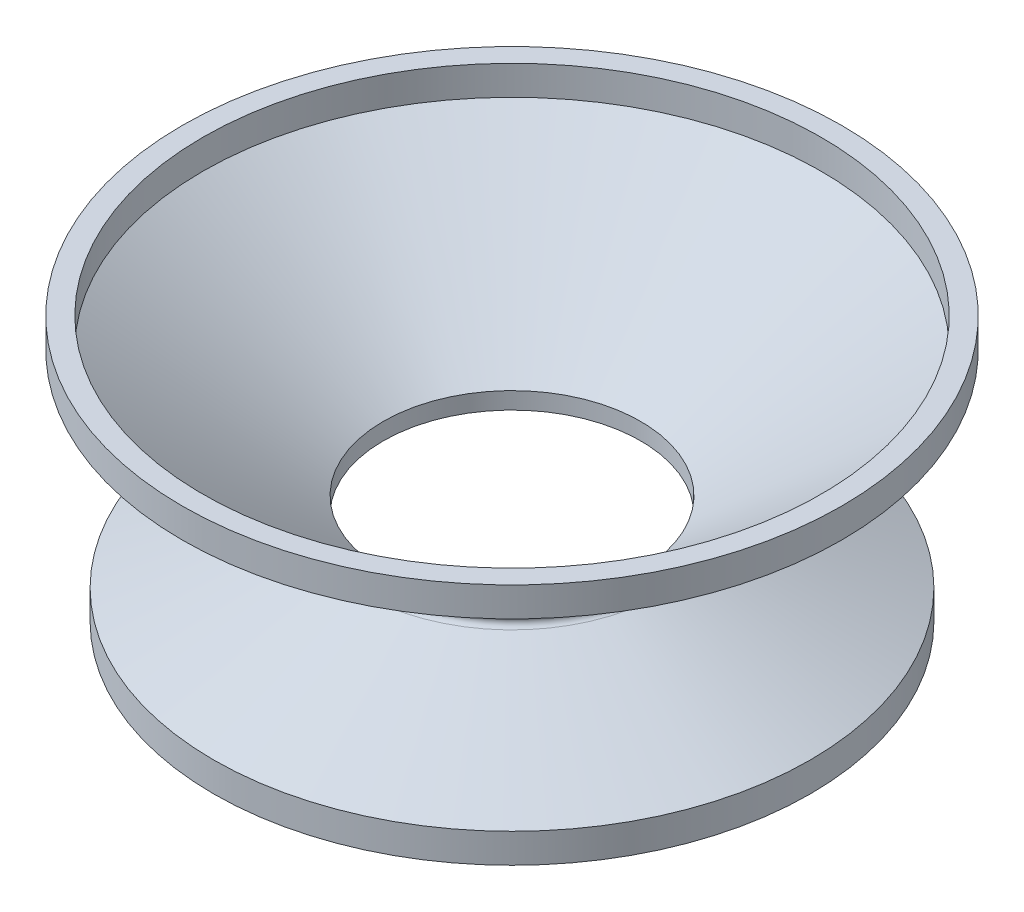
from build123d import *

# Parameters (mm, degrees)
FILLET2_R           = 0.4
SKETCH2_R           = 22.394757436
SKETCH2_R_2         = 21
BOSS_EXTRUDE1_DEPTH = 2
SKETCH3_R           = 20.263959978
SKETCH3_R_2         = 17.897758395
BOSS_EXTRUDE2_DEPTH = 2


with BuildPart() as part:
    # Sketch1 → Revolve1 (revolve)
    with BuildSketch(Plane.XY):
        Polygon((0.662781953, 0), (-12.190550108, 9), (-10.795792672, 9), (1.462781953, 0.41645364), (1.462781953, -0.730331792), (-7.693551067, -5), (-10.05975265, -5), align=None)
    revolve(axis=Axis((10.204207328, 8.609018033, 0), (0, -1, 0)))

    # Fillet2
    fillet2_edges = [part.edges().sort_by_distance(p)[0] for p in [
        (19.745632704, 0, 0),
    ]]
    fillet(fillet2_edges, radius=FILLET2_R)

    # Sketch2 → Boss-Extrude1 (add)
    with BuildSketch(Plane(origin=(0, 9, 0), x_dir=(1, 0, 0), z_dir=(0, 1, 0))):
        with Locations(Location((10.204207328, 0, 0), (0, 0, 180))):
            Circle(SKETCH2_R)
        with Locations(Location((10.204207328, 0, 0), (0, 0, 180))):
            Circle(SKETCH2_R_2, mode=Mode.SUBTRACT)
    extrude(amount=BOSS_EXTRUDE1_DEPTH)

    # Sketch3 → Boss-Extrude2 (add)
    with BuildSketch(Plane.XZ.offset(5)):
        with Locations((10.204207328, 0)):
            Circle(SKETCH3_R)
        with Locations(Location((10.204207328, 0, 0), (0, 0, 180))):
            Circle(SKETCH3_R_2, mode=Mode.SUBTRACT)
    extrude(amount=BOSS_EXTRUDE2_DEPTH)


solid = part.part
